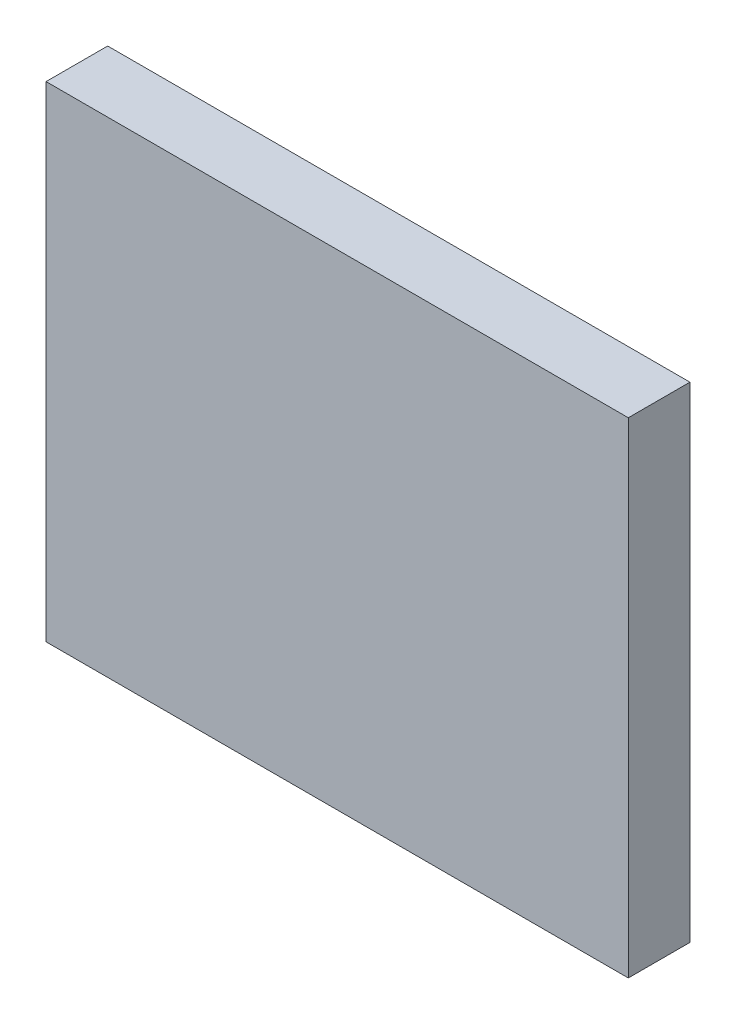
from build123d import *

# Parameters (mm, degrees)
SKETCH1_W           = 240
SKETCH1_H           = 200
BOSS_EXTRUDE1_DEPTH = 25.4


with BuildPart() as part:
    # Sketch1 → Boss-Extrude1 (new body)
    with BuildSketch(Plane.XY):
        Rectangle(SKETCH1_W, SKETCH1_H)
    extrude(amount=BOSS_EXTRUDE1_DEPTH)


solid = part.part
